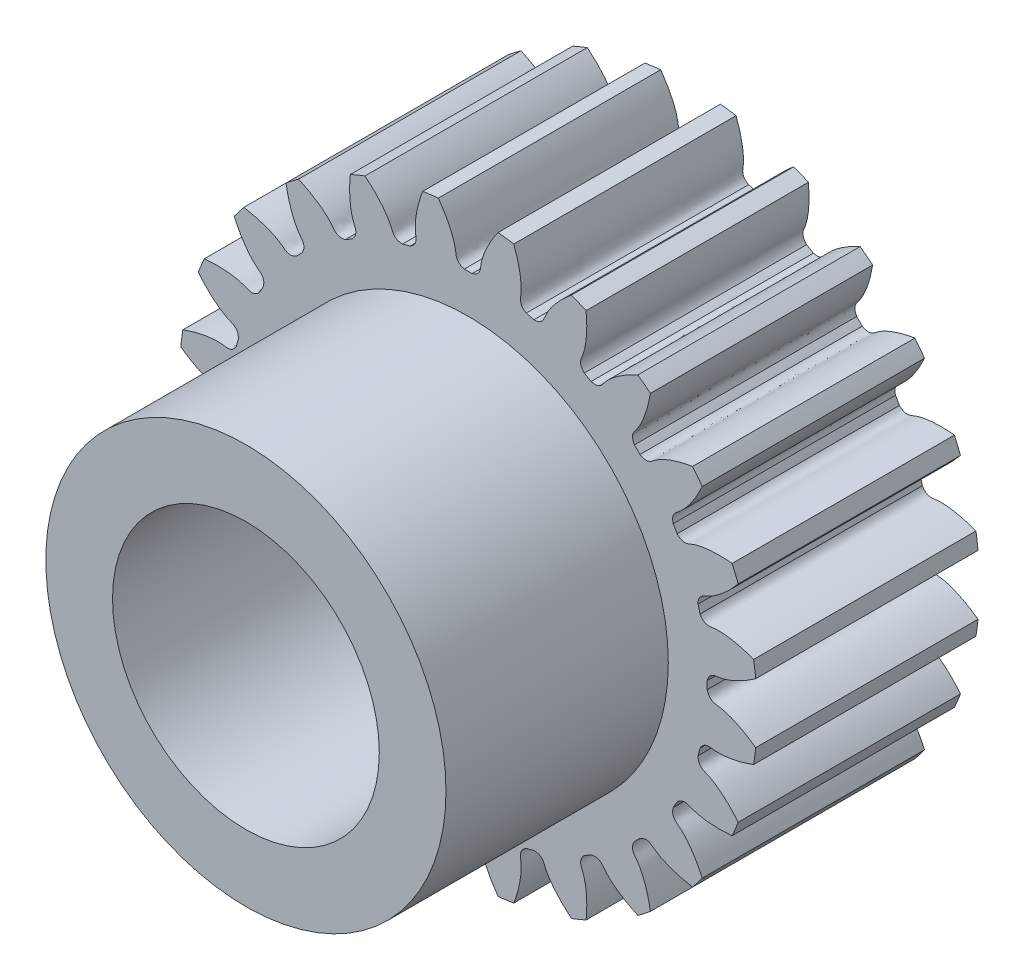
from build123d import *

# Parameters (mm, degrees)
SKETCH_1_R               = 6.5
EXTRUDE_1_DEPTH          = 5
CUT_EXTRUDE_1_DEPTH      = 11.464224768
PATTERN_CIRCULAR_1_COUNT = 24
SKETCH_4_R               = 4.5
EXTRUDE_2_DEPTH          = 5
SKETCH_5_R               = 3
CUT_EXTRUDE_2_DEPTH      = 14.549883576


with BuildPart() as part:
    # 草图1 → 凸台-拉伸1 (new body)
    with BuildSketch(Plane.XY):
        Circle(SKETCH_1_R)
    extrude(amount=EXTRUDE_1_DEPTH)

    # 草图2 → 切除-拉伸1 (cut, through all)
    with BuildSketch(Plane.XY):
        with BuildLine():
            ThreePointArc((0.088415956, 5.374272753), (0, 5.375), (-0.088415956, 5.374272753))
            add(Edge.make_bspline(
                [(-0.088415956, 5.374272753), (-0.283956108, 5.428430036), (-0.269523883, 5.557861799), (-0.293138588, 5.686342226), (-0.296517959, 5.702916521), (-0.300724242, 5.721620073), (-0.305840304, 5.742426358), (-0.311952817, 5.765305336), (-0.319146149, 5.790224685), (-0.327504211, 5.817149434), (-0.337109789, 5.846042111), (-0.348044663, 5.876862729), (-0.360389484, 5.909568827), (-0.374223721, 5.944115495), (-0.389625595, 5.980455405), (-0.406672011, 6.018538843), (-0.425438499, 6.058313744), (-0.445999145, 6.099725726), (-0.468426535, 6.142718129), (-0.492791687, 6.187232054), (-0.519163995, 6.233206399), (-0.547611171, 6.280577906), (-0.57819918, 6.329281201), (-0.610992189, 6.379248841), (-0.64605251, 6.430411359), (-0.68344054, 6.482697309), (-0.723214712, 6.53603332), (-0.765431443, 6.590344144), (-0.810145078, 6.645552705), (-0.857407842, 6.701580158), (-0.907269792, 6.758345935), (-0.959778768, 6.81576781), (-1.014980347, 6.873761948), (-1.0729178, 6.932242967), (-1.133632047, 6.991123994), (-1.197161611, 7.05031673), (-1.263542589, 7.109731505), (-1.332808587, 7.169277345), (-1.430211047, 7.249680778), (-1.505961903, 7.308439159), (-1.55780976, 7.347058965)],
                knots=[0, 0, 0, 0, 0.143961355, 0.149818462, 0.156576662, 0.164235955, 0.172796342, 0.182257821, 0.192620395, 0.203884061, 0.216048821, 0.229114674, 0.24308162, 0.25794966, 0.273718793, 0.290389019, 0.307960339, 0.326432751, 0.345806258, 0.366080857, 0.38725655, 0.409333336, 0.432311215, 0.456190188, 0.480970254, 0.506651413, 0.533233666, 0.560717012, 0.589101451, 0.618386984, 0.64857361, 0.679661329, 0.711650141, 0.744540047, 0.778331046, 0.813023138, 0.848616324, 0.885110603, 0.922505975, 1, 1, 1, 1], degree=3))
            ThreePointArc((-1.55780976, 7.347058965), (0, 7.510395907), (1.55780976, 7.347058965))
            add(Edge.make_bspline(
                [(0.088415956, 5.374272753), (0.283956108, 5.428430036), (0.269523883, 5.557861799), (0.293138588, 5.686342226), (0.296517959, 5.702916521), (0.300724242, 5.721620073), (0.305840304, 5.742426358), (0.311952817, 5.765305336), (0.319146149, 5.790224685), (0.327504211, 5.817149434), (0.337109789, 5.846042111), (0.348044663, 5.876862729), (0.360389484, 5.909568827), (0.374223721, 5.944115495), (0.389625595, 5.980455405), (0.406672011, 6.018538843), (0.425438499, 6.058313744), (0.445999145, 6.099725726), (0.468426535, 6.142718129), (0.492791687, 6.187232054), (0.519163995, 6.233206399), (0.547611171, 6.280577906), (0.57819918, 6.329281201), (0.610992189, 6.379248841), (0.64605251, 6.430411359), (0.68344054, 6.482697309), (0.723214712, 6.53603332), (0.765431443, 6.590344144), (0.810145078, 6.645552705), (0.857407842, 6.701580158), (0.907269792, 6.758345935), (0.959778768, 6.81576781), (1.014980347, 6.873761948), (1.0729178, 6.932242967), (1.133632047, 6.991123994), (1.197161611, 7.05031673), (1.263542589, 7.109731505), (1.332808587, 7.169277345), (1.430211047, 7.249680778), (1.505961903, 7.308439159), (1.55780976, 7.347058965)],
                knots=[0, 0, 0, 0, 0.143961355, 0.149818462, 0.156576662, 0.164235955, 0.172796342, 0.182257821, 0.192620395, 0.203884061, 0.216048821, 0.229114674, 0.24308162, 0.25794966, 0.273718793, 0.290389019, 0.307960339, 0.326432751, 0.345806258, 0.366080857, 0.38725655, 0.409333336, 0.432311215, 0.456190188, 0.480970254, 0.506651413, 0.533233666, 0.560717012, 0.589101451, 0.618386984, 0.64857361, 0.679661329, 0.711650141, 0.744540047, 0.778331046, 0.813023138, 0.848616324, 0.885110603, 0.922505975, 1, 1, 1, 1], degree=3))
        make_face()
    cut_extrude_1 = extrude(amount=CUT_EXTRUDE_1_DEPTH, mode=Mode.SUBTRACT)

    # 阵列(圆周)1: 切除-拉伸1 ×24 about axis
    pattern_circular_1_axis = Axis((0, 0, -0.25), (0, 0, 1))
    for i in range(1, PATTERN_CIRCULAR_1_COUNT):
        add(cut_extrude_1.rotate(pattern_circular_1_axis, i * 360 / PATTERN_CIRCULAR_1_COUNT), mode=Mode.SUBTRACT)

    # 草图4 → 凸台-拉伸2 (add)
    with BuildSketch(Plane.XY.offset(5)):
        Circle(SKETCH_4_R)
    extrude(amount=EXTRUDE_2_DEPTH)

    # 草图5 → 切除-拉伸2 (cut, through all)
    with BuildSketch(Plane.XY.offset(10)):
        Circle(SKETCH_5_R)
    extrude(amount=-CUT_EXTRUDE_2_DEPTH, mode=Mode.SUBTRACT)


solid = part.part
